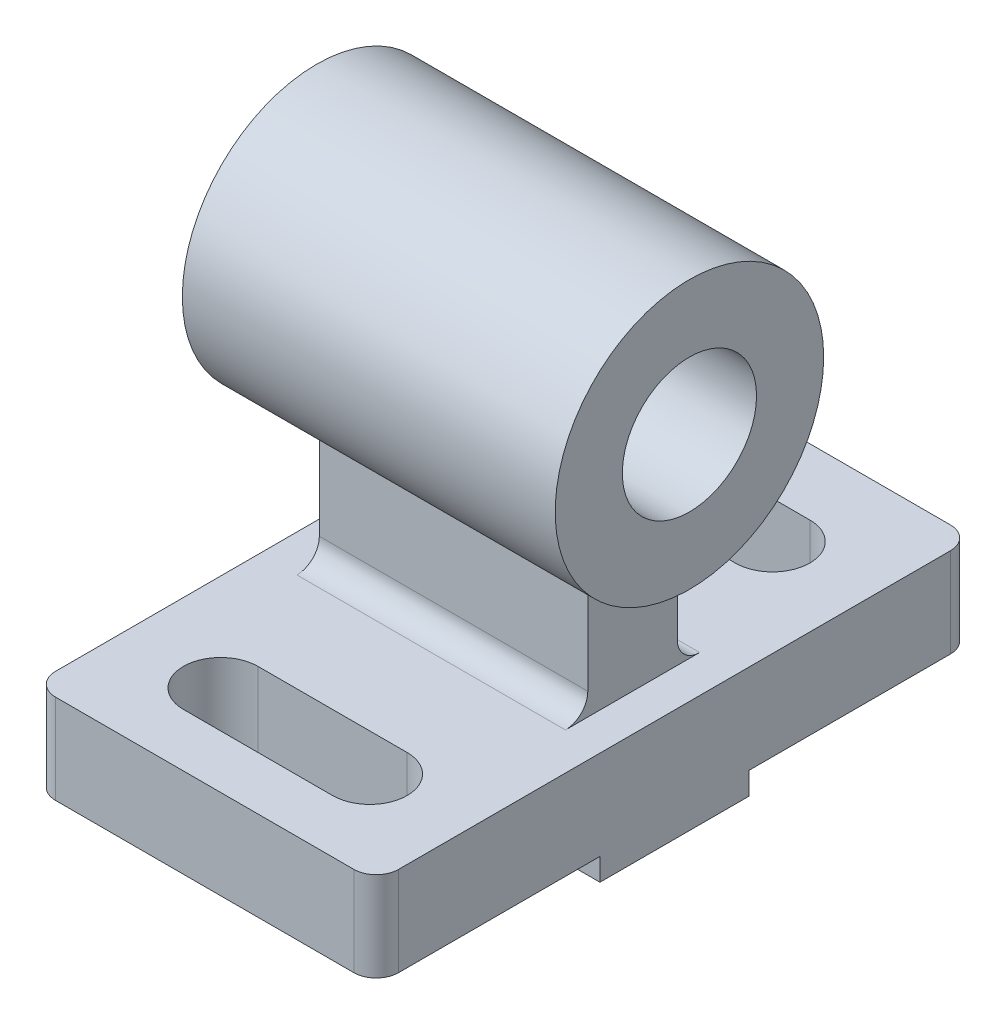
from build123d import *

# Parameters (mm, degrees)
BOSS_EXTRUDE2_DEPTH = 46
FILLET1_R           = 3
CUT_EXTRUDE1_DEPTH  = 46
SKETCH5_R           = 18
SKETCH5_R_2         = 9
BOSS_EXTRUDE3_DEPTH = 50
SKETCH6_R           = 18
SKETCH6_R_2         = 9
BOSS_EXTRUDE4_DEPTH = 2
SKETCH7_R           = 18
SKETCH7_R_2         = 9
CUT_EXTRUDE2_DEPTH  = 2
BOSS_EXTRUDE5_DEPTH = 36
FILLET2_R           = 3


with BuildPart() as part:
    # Sketch3 → Boss-Extrude2 (new body)
    with BuildSketch(Plane(origin=(0, 0, 0), x_dir=(0, 0, -1), z_dir=(1, 0, 0))):
        Polygon((-39.518072289, 0), (-39.518072289, 12), (40.481927711, 12), (40.481927711, 0), (10.481927711, 0), (10.481927711, -3), (-9.518072289, -3), (-9.518072289, 0), align=None)
    extrude(amount=-BOSS_EXTRUDE2_DEPTH)

    # Fillet1
    fillet1_edges = [part.edges().sort_by_distance(p)[0] for p in [
        (-46, 6, -40.481927711),
        (-46, 6, 39.518072289),
        (0, 6, 39.518072289),
        (0, 6, -40.481927711),
    ]]
    fillet(fillet1_edges, radius=FILLET1_R)

    # Sketch4 → Cut-Extrude1 (cut)
    with BuildSketch(Plane(origin=(0, 12, 0), x_dir=(1, 0, 0), z_dir=(0, 1, 0))):
        with BuildLine():
            Line((-33, -22.374092955), (-13, -22.374092955))
            ThreePointArc((-13, -22.374092955), (-8, -27.374092955), (-13, -32.374092955))
            Line((-13, -32.374092955), (-33, -32.374092955))
            ThreePointArc((-33, -32.374092955), (-38, -27.374092955), (-33, -22.374092955))
        make_face()
        with BuildLine():
            Line((-33, 31.625907045), (-13, 31.625907045))
            ThreePointArc((-13, 31.625907045), (-8, 26.625907045), (-13, 21.625907045))
            Line((-13, 21.625907045), (-33, 21.625907045))
            ThreePointArc((-33, 21.625907045), (-38, 26.625907045), (-33, 31.625907045))
        make_face()
    extrude(amount=-CUT_EXTRUDE1_DEPTH, mode=Mode.SUBTRACT)



with BuildPart() as body_2:
    # Sketch5 → Boss-Extrude3 (new body)
    with BuildSketch(Plane(origin=(0, 0, 0), x_dir=(0, 0, -1), z_dir=(1, 0, 0))):
        with Locations((0.481927711, 45)):
            Circle(SKETCH5_R)
        with Locations((0.481927711, 45)):
            Circle(SKETCH5_R_2, mode=Mode.SUBTRACT)
    extrude(amount=-BOSS_EXTRUDE3_DEPTH)

    # Sketch6 → Boss-Extrude4 (add)
    with BuildSketch(Plane(origin=(0, 0, 0), x_dir=(0, 0, -1), z_dir=(1, 0, 0))):
        with Locations((0.481927711, 45)):
            Circle(SKETCH6_R)
        with Locations((0.481927711, 45)):
            Circle(SKETCH6_R_2, mode=Mode.SUBTRACT)
    extrude(amount=BOSS_EXTRUDE4_DEPTH)

    # Sketch7 → Cut-Extrude2 (cut)
    with BuildSketch(Plane.ZY.offset(50)):
        with Locations(Location((-0.481927711, 45, 0), (0, 0, 180))):
            Circle(SKETCH7_R)
        with Locations(Location((-0.481927711, 45, 0), (0, 0, 180))):
            Circle(SKETCH7_R_2, mode=Mode.SUBTRACT)
    extrude(amount=-CUT_EXTRUDE2_DEPTH, mode=Mode.SUBTRACT)


with BuildPart() as part_1:
    add(part.part)

    add(body_2.part)  # Boss-Extrude5 merges body 2
    # Sketch8 → Boss-Extrude5 (add)
    with BuildSketch(Plane(origin=(-5, 0, 0), x_dir=(0, 0, -1), z_dir=(1, 0, 0))):
        with BuildLine():
            Line((-6.148609037, 28.265724323), (-6.148609037, 12))
            Line((-6.148609037, 12), (5.851390963, 12))
            Line((5.851390963, 12), (5.851390963, 27.819520834))
            ThreePointArc((5.851390963, 27.819520834), (-0.186915304, 27.012430708), (-6.148609037, 28.265724323))
        make_face()
    extrude(amount=-BOSS_EXTRUDE5_DEPTH)

    # Fillet2
    fillet2_edges = [part_1.edges().sort_by_distance(p)[0] for p in [
        (-23, 12, -5.851390963),
        (-23, 12, 6.148609037),
    ]]
    fillet(fillet2_edges, radius=FILLET2_R)


solid = part_1.part
